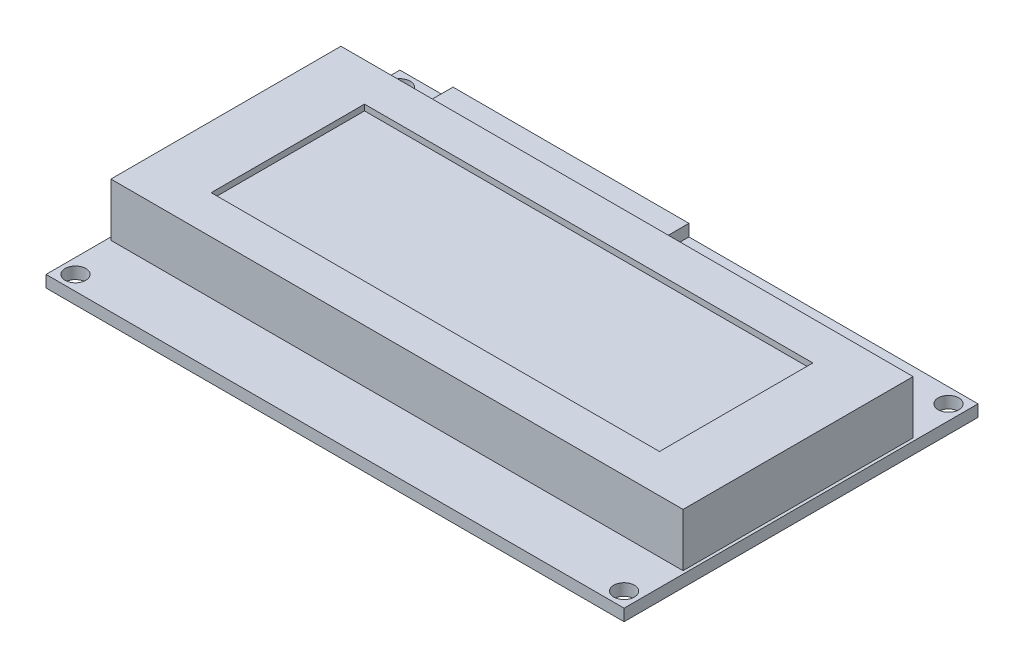
from build123d import *

# Parameters (mm, degrees)
SKETCH1_W           = 98
SKETCH1_H           = 60
BOSS_EXTRUDE1_DEPTH = 2
SKETCH2_W           = 97
SKETCH2_H           = 39
BOSS_EXTRUDE2_DEPTH = 9
SKETCH3_W           = 76
SKETCH3_H           = 26
CUT_EXTRUDE1_DEPTH  = 1
SKETCH4_W           = 41.5
SKETCH4_H           = 19
BOSS_EXTRUDE3_DEPTH = 8
SKETCH5_R           = 1.75
CUT_EXTRUDE2_DEPTH  = 59.318093247
SKETCH6_W           = 40
SKETCH6_H           = 4
BOSS_EXTRUDE4_DEPTH = 2


with BuildPart() as part:
    # Sketch1 → Boss-Extrude1 (new body)
    with BuildSketch(Plane(origin=(0, 0, 0), x_dir=(1, 0, 0), z_dir=(0, 1, 0))):
        Rectangle(SKETCH1_W, SKETCH1_H)
    extrude(amount=BOSS_EXTRUDE1_DEPTH)

    # Sketch5 → Cut-Extrude2 (cut, through all)
    with BuildSketch(Plane(origin=(0, 2, 0), x_dir=(1, 0, 0), z_dir=(0, 1, 0))):
        with Locations(Location((-46.5, 27.5, 0), (0, 0, 270))):
            Circle(SKETCH5_R)
        with Locations(Location((46.5, 27.5, 0), (0, 0, 270))):
            Circle(SKETCH5_R)
        with Locations(Location((46.5, -27.5, 0), (0, 0, 270))):
            Circle(SKETCH5_R)
        with Locations(Location((-46.5, -27.5, 0), (0, 0, 270))):
            Circle(SKETCH5_R)
    extrude(amount=-CUT_EXTRUDE2_DEPTH, mode=Mode.SUBTRACT)


with BuildPart() as body_2:
    # Sketch2 → Boss-Extrude2 (new body)
    with BuildSketch(Plane(origin=(0, 2, 0), x_dir=(1, 0, 0), z_dir=(0, 1, 0))):
        Rectangle(SKETCH2_W, SKETCH2_H)
    extrude(amount=BOSS_EXTRUDE2_DEPTH)

    # Sketch3 → Cut-Extrude1 (cut)
    with BuildSketch(Plane(origin=(0, 11, 0), x_dir=(1, 0, 0), z_dir=(0, 1, 0))):
        Rectangle(SKETCH3_W, SKETCH3_H)
    extrude(amount=-CUT_EXTRUDE1_DEPTH, mode=Mode.SUBTRACT)


with BuildPart() as body_3:
    # Sketch4 → Boss-Extrude3 (new body)
    with BuildSketch(Plane.XZ):
        with Locations((-20.25, -19)):
            Rectangle(SKETCH4_W, SKETCH4_H)
    extrude(amount=BOSS_EXTRUDE3_DEPTH)


with BuildPart() as body_4:
    # Sketch6 → Boss-Extrude4 (new body)
    with BuildSketch(Plane(origin=(0, 2, 0), x_dir=(1, 0, 0), z_dir=(0, 1, 0))):
        with Locations((-20, 28)):
            Rectangle(SKETCH6_W, SKETCH6_H)
    extrude(amount=BOSS_EXTRUDE4_DEPTH)


solid = Compound([part.part, body_2.part, body_3.part, body_4.part])
